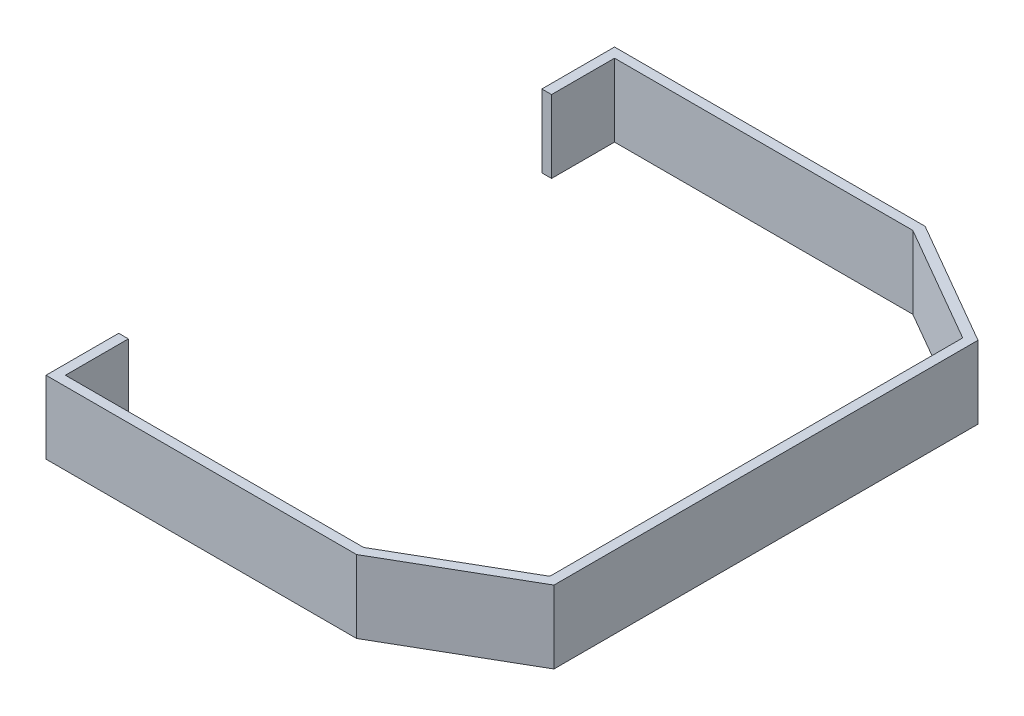
from build123d import *

# Parameters (mm, degrees)
BOSS_EXTRUDE1_DEPTH = 30


with BuildPart() as part:
    # Sketch6 → Boss-Extrude1 (new body)
    with BuildSketch(Plane(origin=(0, 0, 0), x_dir=(1, 0, 0), z_dir=(0, 1, 0))):
        Polygon((0, 117.32), (90.67, 117.32), (142.319755082, 87.5), (142.319755082, -87.5), (90.67, -117.32), (0, -117.32), (-37.5, -117.32), (-37.5, -87.32), (-33.5, -87.32), (-33.5, -113.32), (0, -113.32), (89.59820323, -113.32), (138.319755082, -85.190598923), (138.319755082, 85.190598923), (89.59820323, 113.32), (0, 113.32), (-33.5, 113.32), (-33.5, 87.32), (-37.5, 87.32), (-37.5, 117.32), align=None)
    extrude(amount=BOSS_EXTRUDE1_DEPTH)


solid = part.part
